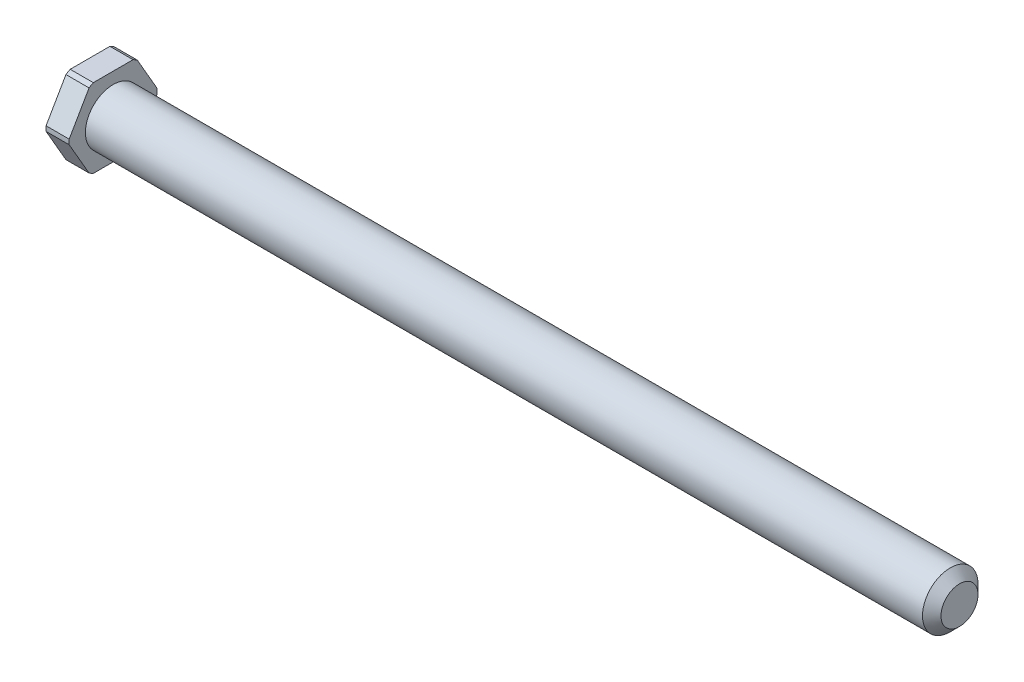
from build123d import *

# Parameters (mm, degrees)
CHAFL_N1_SIZE         = 2
CORTAR_EXTRUIR1_REACH = 190.482


with BuildPart() as part:
    # Croquis1 → Revolución1 (revolve)
    with BuildSketch(Plane.XY, mode=Mode.PRIVATE) as revoluci_n1_sk:
        Polygon((0, 0), (188, 0), (188, 6), (5, 6), (5, 9.525), (0, 9.525), align=None)
    revolve(revoluci_n1_sk.sketch.rotate(Axis((0, 0, 0), (1, 0, 0)), 90), axis=Axis((0, 0, 0), (1, 0, 0)))

    # Chaflán1
    chafl_n1_edges = [part.edges().sort_by_distance(p)[0] for p in [
        (188, 0, -6),
    ]]
    chamfer(chafl_n1_edges, length=CHAFL_N1_SIZE)

    # Croquis2 → Cortar-Extruir1 (cut, up to next)
    with BuildSketch(Plane.ZY, mode=Mode.PRIVATE) as cortar_extruir1_sk1:
        with BuildLine():
            Line((-4.298328163, 8.5), (4.298328163, 8.5))
            ThreePointArc((4.298328163, 8.5), (0, 9.525), (-4.298328163, 8.5))
        make_face()
    cortar_extruir1_tool1 = extrude(cortar_extruir1_sk1.sketch, amount=-CORTAR_EXTRUIR1_REACH, mode=Mode.PRIVATE) & part.part
    # Croquis2 → Cortar-Extruir1 (cut, up to next)
    with BuildSketch(Plane.ZY, mode=Mode.PRIVATE) as cortar_extruir1_sk2:
        with BuildLine():
            Line((-9.510380014, 0.527538617), (-5.21205185, 7.972461383))
            ThreePointArc((-5.21205185, 7.972461383), (-8.248891971, 4.7625), (-9.510380014, 0.527538617))
        make_face()
    cortar_extruir1_tool2 = extrude(cortar_extruir1_sk2.sketch, amount=-CORTAR_EXTRUIR1_REACH, mode=Mode.PRIVATE) & part.part
    # Croquis2 → Cortar-Extruir1 (cut, up to next)
    with BuildSketch(Plane.ZY, mode=Mode.PRIVATE) as cortar_extruir1_sk3:
        with BuildLine():
            Line((-5.21205185, -7.972461383), (-9.510380014, -0.527538617))
            ThreePointArc((-9.510380014, -0.527538617), (-8.248891971, -4.7625), (-5.21205185, -7.972461383))
        make_face()
    cortar_extruir1_tool3 = extrude(cortar_extruir1_sk3.sketch, amount=-CORTAR_EXTRUIR1_REACH, mode=Mode.PRIVATE) & part.part
    # Croquis2 → Cortar-Extruir1 (cut, up to next)
    with BuildSketch(Plane.ZY, mode=Mode.PRIVATE) as cortar_extruir1_sk4:
        with BuildLine():
            ThreePointArc((-4.298328163, -8.5), (0, -9.525), (4.298328163, -8.5))
            Line((4.298328163, -8.5), (-4.298328163, -8.5))
        make_face()
    cortar_extruir1_tool4 = extrude(cortar_extruir1_sk4.sketch, amount=-CORTAR_EXTRUIR1_REACH, mode=Mode.PRIVATE) & part.part
    # Croquis2 → Cortar-Extruir1 (cut, up to next)
    with BuildSketch(Plane.ZY, mode=Mode.PRIVATE) as cortar_extruir1_sk5:
        with BuildLine():
            ThreePointArc((5.21205185, -7.972461383), (8.248891971, -4.7625), (9.510380014, -0.527538617))
            Line((9.510380014, -0.527538617), (5.21205185, -7.972461383))
        make_face()
    cortar_extruir1_tool5 = extrude(cortar_extruir1_sk5.sketch, amount=-CORTAR_EXTRUIR1_REACH, mode=Mode.PRIVATE) & part.part
    # Croquis2 → Cortar-Extruir1 (cut, up to next)
    with BuildSketch(Plane.ZY, mode=Mode.PRIVATE) as cortar_extruir1_sk6:
        with BuildLine():
            ThreePointArc((9.510380014, 0.527538617), (8.248891971, 4.7625), (5.21205185, 7.972461383))
            Line((5.21205185, 7.972461383), (9.510380014, 0.527538617))
        make_face()
    cortar_extruir1_tool6 = extrude(cortar_extruir1_sk6.sketch, amount=-CORTAR_EXTRUIR1_REACH, mode=Mode.PRIVATE) & part.part
    add(cortar_extruir1_tool1.solids().sort_by_distance((0, 8.911952, 0))[0], mode=Mode.SUBTRACT)
    add(cortar_extruir1_tool2.solids().sort_by_distance((0, 4.455976, -7.717977))[0], mode=Mode.SUBTRACT)
    add(cortar_extruir1_tool3.solids().sort_by_distance((0, -4.455976, -7.717977))[0], mode=Mode.SUBTRACT)
    add(cortar_extruir1_tool4.solids().sort_by_distance((0, -8.911952, 0))[0], mode=Mode.SUBTRACT)
    add(cortar_extruir1_tool5.solids().sort_by_distance((0, -4.455976, 7.717977))[0], mode=Mode.SUBTRACT)
    add(cortar_extruir1_tool6.solids().sort_by_distance((0, 4.455976, 7.717977))[0], mode=Mode.SUBTRACT)


solid = part.part
